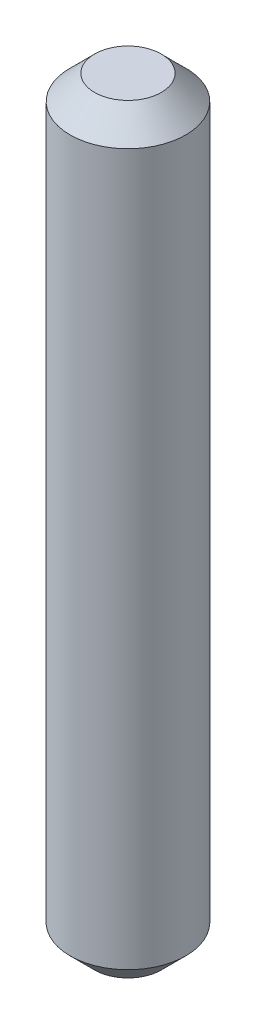
from build123d import *

# Parameters (mm, degrees)
SKETCH2_R           = 2.9972
BOSS_EXTRUDE1_DEPTH = 39.37
CHAMFER1_SIZE       = 1.27


with BuildPart() as part:
    # Sketch2 → Boss-Extrude1 (new body)
    with BuildSketch(Plane(origin=(0, 0, 0), x_dir=(1, 0, 0), z_dir=(0, 1, 0))):
        with Locations(Location((0, 0, 0), (0, 0, 270))):
            Circle(SKETCH2_R)
    extrude(amount=BOSS_EXTRUDE1_DEPTH)

    # Chamfer1
    chamfer1_edges = [part.edges().sort_by_distance(p)[0] for p in [
        (0, 0, -2.9972),
        (0, 39.37, -2.9972),
    ]]
    chamfer(chamfer1_edges, length=CHAMFER1_SIZE)


solid = part.part
